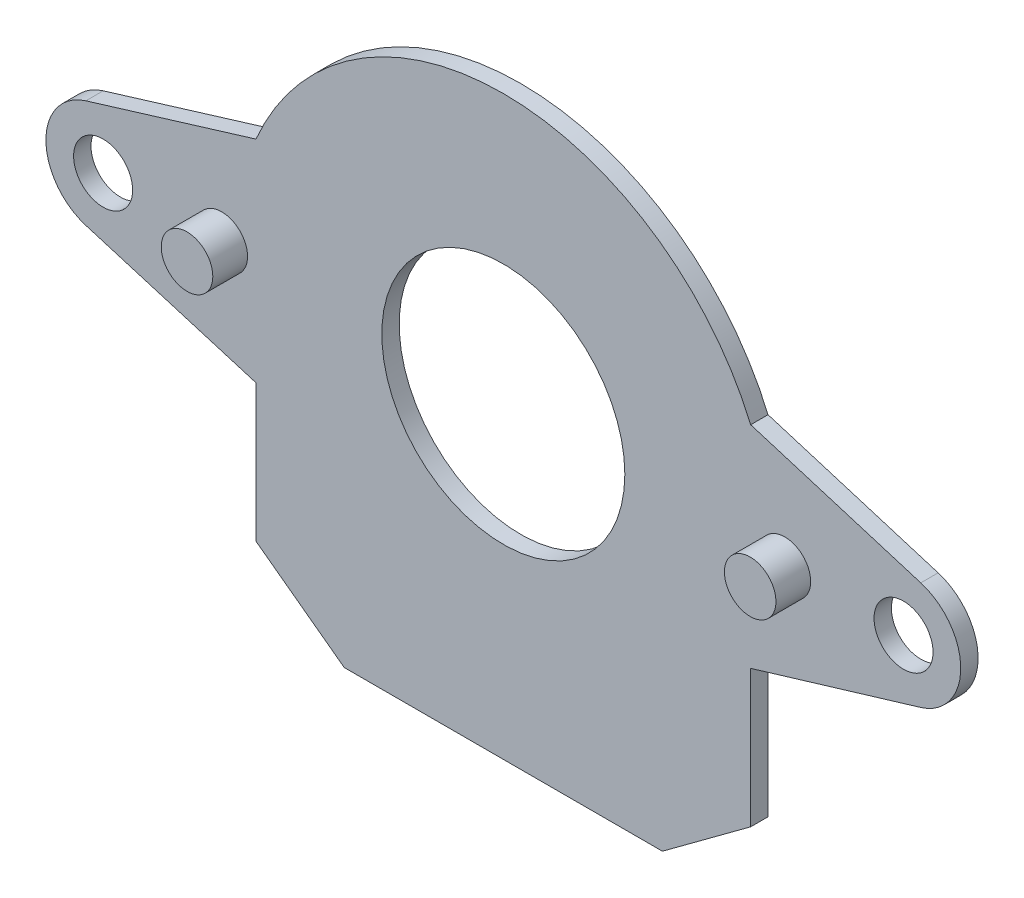
from build123d import *

# Parameters (mm, degrees)
SKETCH1_R           = 7
BOSS_EXTRUDE1_DEPTH = 1
SKETCH2_R           = 1.485
BOSS_EXTRUDE2_DEPTH = 2
SKETCH2_5_R         = 1.7
CUT_EXTRUDE1_DEPTH  = 32.818104658


with BuildPart() as part:
    # Sketch1 → Boss-Extrude1 (new body)
    with BuildSketch(Plane.XY):
        with BuildLine():
            Line((9.165, -17.722), (14.25, -13.9625))
            Line((14.25, -13.9625), (14.25, -6.056))
            Line((14.25, -6.056), (24.036185701, -3.112242975))
            ThreePointArc((24.036185701, -3.112242975), (26.349993684, -0.006407429), (24.048450078, 3.108527376))
            Line((24.048450078, 3.108527376), (14.25, 6.098155459))
            ThreePointArc((14.25, 6.098155459), (8.536058528, 12.937762743), (0, 15.5))
            ThreePointArc((0, 15.5), (-8.536058528, 12.937762743), (-14.25, 6.098155459))
            Line((-14.25, 6.098155459), (-24.048450078, 3.108527376))
            ThreePointArc((-24.048450078, 3.108527376), (-26.349993684, -0.006407429), (-24.036185701, -3.112242975))
            Line((-24.036185701, -3.112242975), (-14.25, -6.056))
            Line((-14.25, -6.056), (-14.25, -13.9625))
            Line((-14.25, -13.9625), (-9.165, -17.722))
            Line((-9.165, -17.722), (9.165, -17.722))
        make_face()
        Circle(SKETCH1_R, mode=Mode.SUBTRACT)
    extrude(amount=BOSS_EXTRUDE1_DEPTH)

    # Sketch2 → Boss-Extrude2 (add)
    with BuildSketch(Plane.XY.offset(1)):
        with Locations((-16.22, 0)):
            Circle(SKETCH2_R)
        with Locations((16.22, 0)):
            Circle(SKETCH2_R)
    extrude(amount=BOSS_EXTRUDE2_DEPTH)

    # Sketch2<5> → Cut-Extrude1 (cut, through all)
    with BuildSketch(Plane.XY.offset(1)):
        with Locations((-23.055, 0)):
            Circle(SKETCH2_5_R)
        with Locations((23.055, 0)):
            Circle(SKETCH2_5_R)
    extrude(amount=-CUT_EXTRUDE1_DEPTH, mode=Mode.SUBTRACT)


solid = part.part
